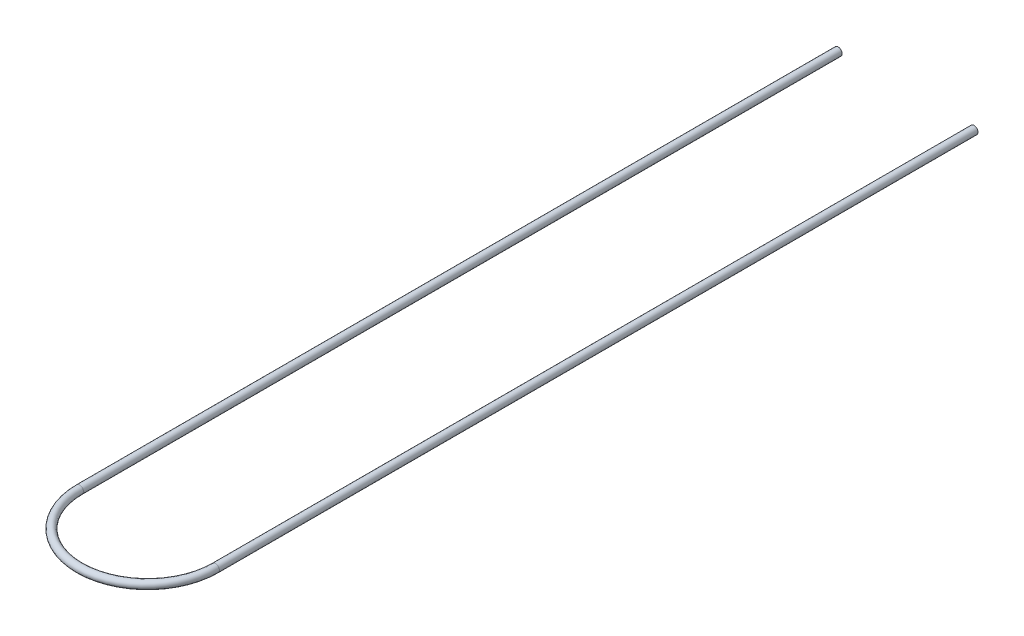
from build123d import *

# Parameters (mm, degrees)
SKETCH2_R   = 11.1
SKETCH2_R_2 = 9.95


with BuildPart() as part:
    # Sweep1: sweep along a path in Sketch1
    with BuildLine(Plane(origin=(0, 0, 0), x_dir=(1, 0, 0), z_dir=(0, 1, 0))) as sweep1_path:
        Line((343.39, -300), (343.39, -2440))
        ThreePointArc((343.39, -2440), (151.695, -2631.695), (-40, -2440))
        Line((-40, -2440), (-40, -300))
    # Sketch2 → Sweep1 (sweep)
    with BuildSketch(Plane(origin=(343.39, 0, 300), x_dir=(-1, 0, 0), z_dir=(0, 0, -1))):
        Circle(SKETCH2_R)
        Circle(SKETCH2_R_2, mode=Mode.SUBTRACT)
    sweep(path=sweep1_path.line)


solid = part.part
